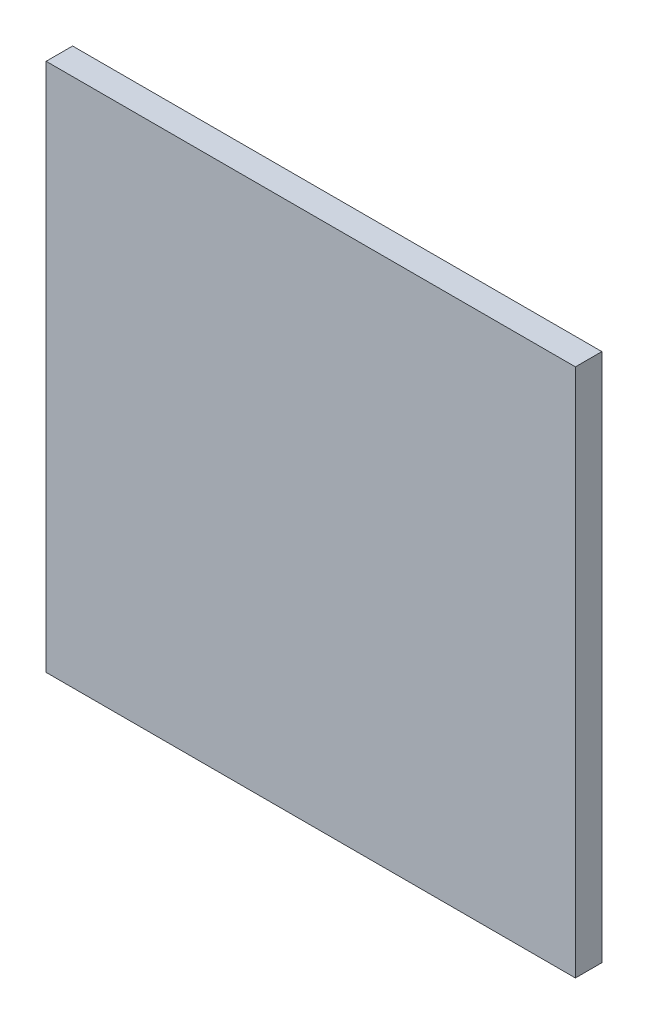
from build123d import *

# Parameters (mm, degrees)
SKETCH1_W           = 10
SKETCH1_H           = 10
BOSS_EXTRUDE1_DEPTH = 0.5


with BuildPart() as part:
    # Sketch1 → Boss-Extrude1 (new body)
    with BuildSketch(Plane.XY):
        with Locations((5, -5)):
            Rectangle(SKETCH1_W, SKETCH1_H)
    extrude(amount=BOSS_EXTRUDE1_DEPTH)


solid = part.part
